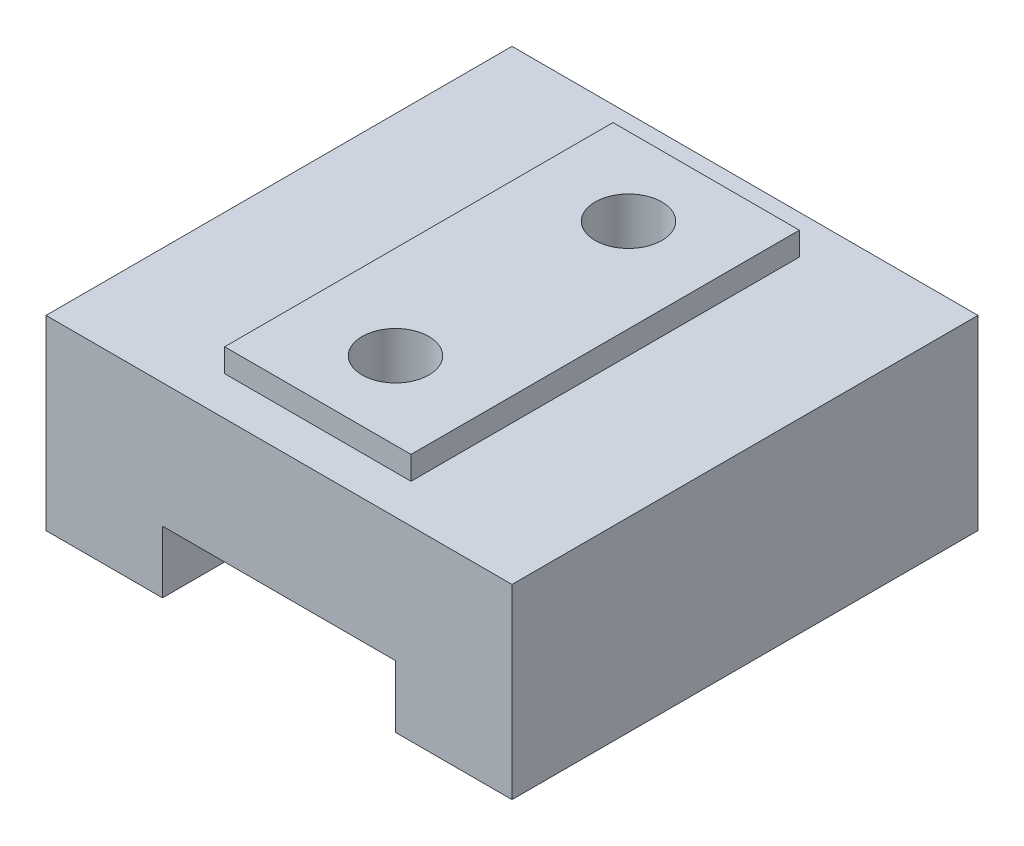
from build123d import *

# Parameters (mm, degrees)
SKETCH1_W           = 30
SKETCH1_H           = 30
BOSS_EXTRUDE1_DEPTH = 12
SKETCH2_R           = 2.15
CUT_EXTRUDE1_DEPTH  = 25.372115214
BOSS_EXTRUDE2_START = 1.5
SKETCH2_3_W         = 12
SKETCH2_3_H         = 25
SKETCH2_3_R         = 2.15
BOSS_EXTRUDE2_DEPTH = 1.5
SKETCH3_W           = 15
SKETCH3_H           = 30
CUT_EXTRUDE2_DEPTH  = 4


with BuildPart() as part:
    # Sketch1 → Boss-Extrude1 (new body)
    with BuildSketch(Plane(origin=(0, 0, 0), x_dir=(1, 0, 0), z_dir=(0, 1, 0))):
        Rectangle(SKETCH1_W, SKETCH1_H)
    extrude(amount=BOSS_EXTRUDE1_DEPTH)

    # Sketch2 → Cut-Extrude1 (cut, through all)
    with BuildSketch(Plane(origin=(0, 12, 0), x_dir=(1, 0, 0), z_dir=(0, 1, 0))):
        with Locations((0, -7.5)):
            Circle(SKETCH2_R)
        with Locations((0, 7.5)):
            Circle(SKETCH2_R)
    extrude(amount=-CUT_EXTRUDE1_DEPTH, mode=Mode.SUBTRACT)

    # Sketch2<3> → Boss-Extrude2 (add)
    with BuildSketch(Plane(origin=(0, 12, 0), x_dir=(1, 0, 0), z_dir=(0, 1, 0)).offset(BOSS_EXTRUDE2_START)):
        Rectangle(SKETCH2_3_W, SKETCH2_3_H)
        with Locations((0, -7.5)):
            Circle(SKETCH2_3_R, mode=Mode.SUBTRACT)
        with Locations((0, 7.5)):
            Circle(SKETCH2_3_R, mode=Mode.SUBTRACT)
    extrude(amount=-BOSS_EXTRUDE2_DEPTH)

    # Sketch3 → Cut-Extrude2 (cut)
    with BuildSketch(Plane.XZ):
        Rectangle(SKETCH3_W, SKETCH3_H)
    extrude(amount=-CUT_EXTRUDE2_DEPTH, mode=Mode.SUBTRACT)


solid = part.part
